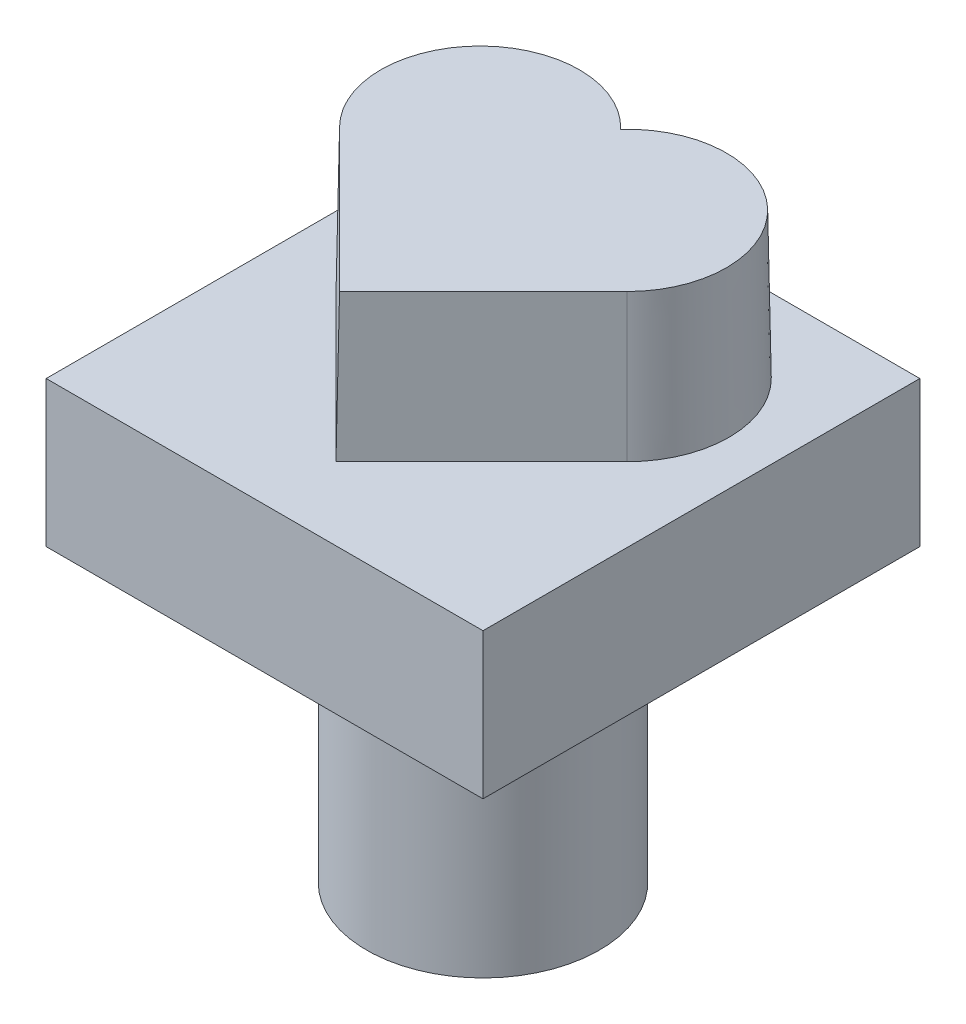
from build123d import *

# Parameters (mm, degrees)
SKETCH1_W           = 15
SKETCH1_H           = 15
BOSS_EXTRUDE1_DEPTH = 5
BOSS_EXTRUDE2_DEPTH = 5
BOSS_EXTRUDE2_TAPER = 1
SKETCH3_R           = 4
BOSS_EXTRUDE3_DEPTH = 10


with BuildPart() as part:
    # Sketch1 → Boss-Extrude1 (new body)
    with BuildSketch(Plane(origin=(0, 0, 0), x_dir=(1, 0, 0), z_dir=(0, 1, 0))):
        Rectangle(SKETCH1_W, SKETCH1_H)
    extrude(amount=BOSS_EXTRUDE1_DEPTH)

    # Sketch2 → Boss-Extrude2 (add)
    with BuildSketch(Plane(origin=(0, 5, 0), x_dir=(1, 0, 0), z_dir=(0, 1, 0))):
        with BuildLine():
            Line((-4.999500013, -0.049742391), (-0.049747468, -4.999494936))
            Line((-0.049747468, -4.999494936), (4.949747468, 0))
            ThreePointArc((4.949747468, 0), (4.924747439, 4.974497472), (-0.049247481, 4.89949991))
            ThreePointArc((-0.049247481, 4.89949991), (-4.999247442, 4.900257622), (-4.999500013, -0.049742391))
        make_face()
    extrude(amount=BOSS_EXTRUDE2_DEPTH, taper=BOSS_EXTRUDE2_TAPER)

    # Sketch3 → Boss-Extrude3 (add)
    with BuildSketch(Plane.XZ):
        with Locations(Location((0, 0, 0), (0, 0, 270))):
            Circle(SKETCH3_R)
    extrude(amount=BOSS_EXTRUDE3_DEPTH)


solid = part.part
